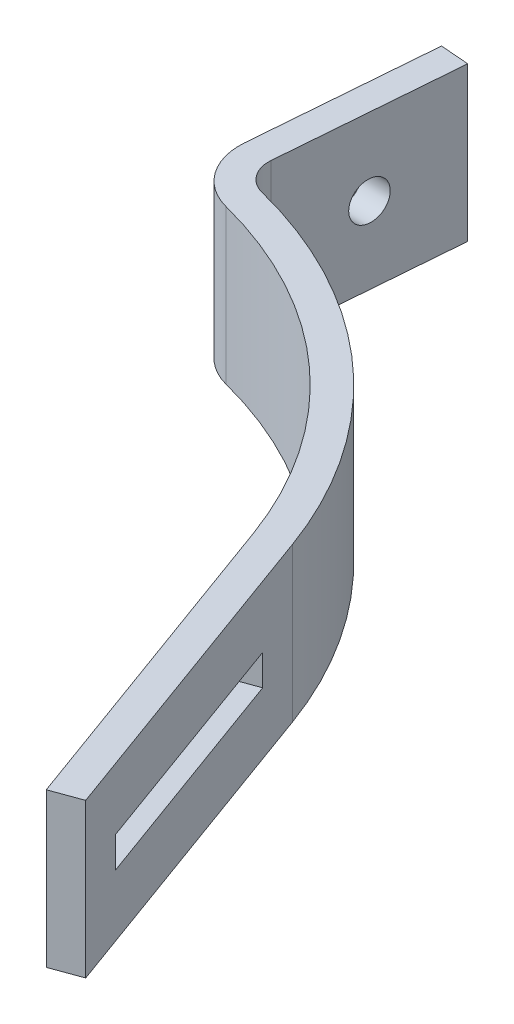
from build123d import *

# Parameters (mm, degrees)
EXTRUDE_1_DEPTH     = 10
SKETCH_2_R          = 1.25
CUT_EXTRUDE_1_DEPTH = 64.188882811
SKETCH_3_W          = 16
SKETCH_3_H          = 2
CUT_EXTRUDE_2_DEPTH = 10


with BuildPart() as part:
    # Эскиз1 → Бобышка-Вытянуть1 (new body)
    with BuildSketch(Plane(origin=(0, 0, 0), x_dir=(1, 0, 0), z_dir=(0, 1, 0))):
        with BuildLine():
            Line((-28.118262676, 42.740270437), (-27.170876932, 54.566519955))
            Line((-27.170876932, 54.566519955), (-29.023121545, 54.714900905))
            Line((-29.023121545, 54.714900905), (-29.972465165, 42.864211138))
            ThreePointArc((-29.972465165, 42.864211138), (-29.243677502, 40.224761685), (-26.987939543, 38.672514561))
            ThreePointArc((-26.987939543, 38.672514561), (-15.177415755, 32.289756522), (-7.695453225, 21.143083968))
            Line((-7.695453225, 21.143083968), (0, 0))
            Line((0, 0), (1.879385242, 0.684040287))
            Line((1.879385242, 0.684040287), (-5.816067983, 21.827124254))
            ThreePointArc((-5.816067983, 21.827124254), (-13.882439346, 33.815300424), (-26.617286688, 40.642186829))
            ThreePointArc((-26.617286688, 40.642186829), (-27.751256034, 41.416884799), (-28.118262676, 42.740270437))
        make_face()
    extrude(amount=EXTRUDE_1_DEPTH)

    # Эскиз2 → Вырез-Вытянуть1 (cut, through all)
    with BuildSketch(Plane(origin=(0, 0, 0), x_dir=(0, 0, -1), z_dir=(1, 0, 0))):
        with Locations((48.653395196, 5)):
            Circle(SKETCH_2_R)
    extrude(amount=-CUT_EXTRUDE_1_DEPTH, mode=Mode.SUBTRACT)

    # Эскиз3 → Вырез-Вытянуть2 (cut)
    with BuildSketch(Plane(origin=(1.879385242, 0, -0.684040287), x_dir=(-0.34202014332566943, 0, -0.9396926207859082), z_dir=(0.9396926207859082, 0, -0.34202014332566943))):
        with Locations((11.25, 5)):
            Rectangle(SKETCH_3_W, SKETCH_3_H)
    extrude(amount=-CUT_EXTRUDE_2_DEPTH, mode=Mode.SUBTRACT)


solid = part.part
